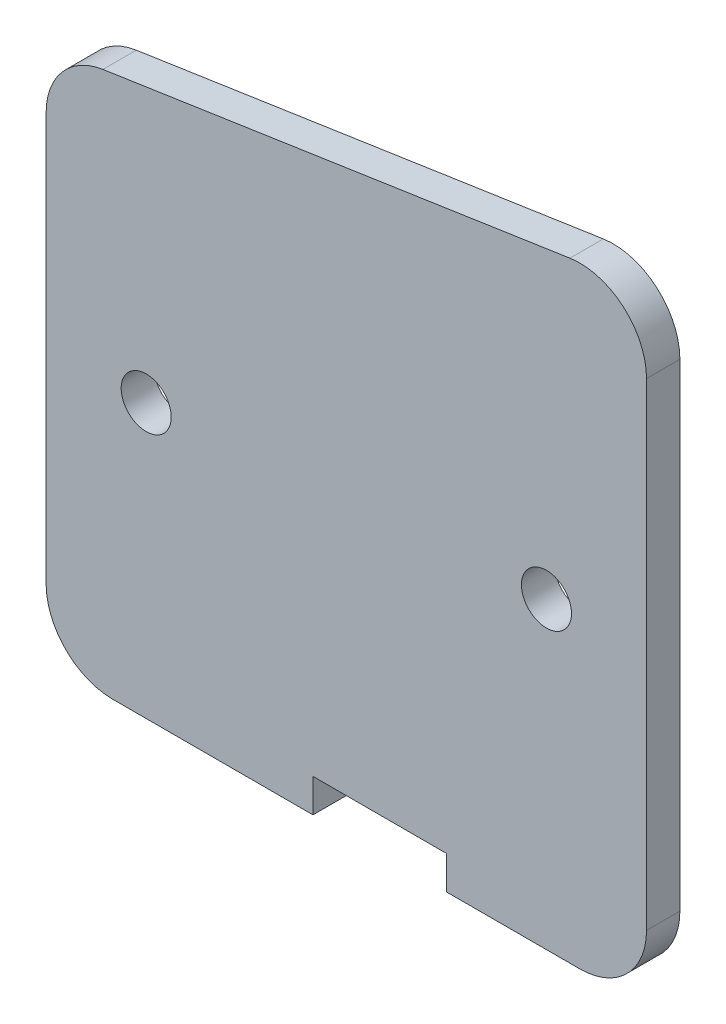
from build123d import *

# Parameters (mm, degrees)
BOSS_EXTRUDE1_DEPTH = 3.175


with BuildPart() as part:
    # Sketch1 → Boss-Extrude1 (new body)
    with BuildSketch(Plane.XY):
        with BuildLine():
            Line((-79.375, 0), (-76.2, 0))
            Line((-76.2, 0), (-76.2, 23.65375))
            ThreePointArc((-76.2, 23.65375), (-78.58125, 26.035), (-76.2, 28.41625))
            Line((-76.2, 28.41625), (-76.2, 52.07))
            Line((-76.2, 52.07), (-80.316961876, 51.452455719))
            ThreePointArc((-80.316961876, 51.452455719), (-84.186650336, 49.316442621), (-85.725, 45.172709878))
            Line((-85.725, 45.172709878), (-85.725, 6.35))
            ThreePointArc((-85.725, 6.35), (-83.865128061, 1.859871939), (-79.375, 0))
        make_face()
        with BuildLine():
            Line((-76.2, 0), (-60.325, 0))
            Line((-60.325, 0), (-60.325, 3.175))
            Line((-60.325, 3.175), (-47.625, 3.175))
            Line((-47.625, 3.175), (-47.625, 0))
            Line((-47.625, 0), (-38.1, 0))
            Line((-38.1, 0), (-38.1, 26.51125))
            ThreePointArc((-38.1, 26.51125), (-40.48125, 28.8925), (-38.1, 31.27375))
            Line((-38.1, 31.27375), (-38.1, 57.785))
            Line((-38.1, 57.785), (-76.2, 52.07))
            Line((-76.2, 52.07), (-76.2, 28.41625))
            ThreePointArc((-76.2, 28.41625), (-74.516201977, 27.718798023), (-73.81875, 26.035))
            ThreePointArc((-73.81875, 26.035), (-74.516201977, 24.351201977), (-76.2, 23.65375))
            Line((-76.2, 23.65375), (-76.2, 0))
        make_face()
        with BuildLine():
            Line((-38.1, 26.51125), (-38.1, 0))
            Line((-38.1, 0), (-34.925, 0))
            ThreePointArc((-34.925, 0), (-30.434871939, 1.859871939), (-28.575, 6.35))
            Line((-28.575, 6.35), (-28.575, 51.840209878))
            ThreePointArc((-28.575, 51.840209878), (-30.781267257, 56.651860214), (-35.866961876, 58.119955719))
            Line((-35.866961876, 58.119955719), (-38.1, 57.785))
            Line((-38.1, 57.785), (-38.1, 31.27375))
            ThreePointArc((-38.1, 31.27375), (-36.416201977, 30.576298023), (-35.71875, 28.8925))
            ThreePointArc((-35.71875, 28.8925), (-36.416201977, 27.208701977), (-38.1, 26.51125))
        make_face()
    extrude(amount=BOSS_EXTRUDE1_DEPTH)


solid = part.part
